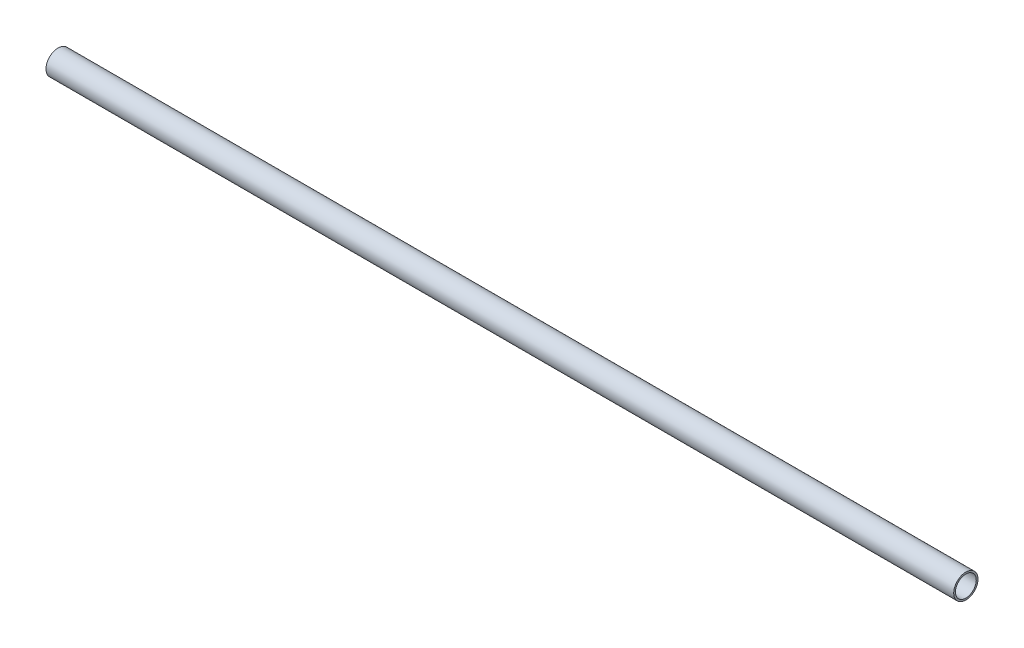
from build123d import *

# Parameters (mm, degrees)
IZIM1_R                     = 7
IZIM1_R_2                   = 6
Y_KSEKLIK_EKSTR_ZYON1_DEPTH = 261.5


with BuildPart() as part:
    # Çizim1 → Yükseklik-Ekstrüzyon1 (new, symmetric)
    with BuildSketch(Plane(origin=(0, 0, 0), x_dir=(0, 0, -1), z_dir=(1, 0, 0))):
        Circle(IZIM1_R)
        Circle(IZIM1_R_2, mode=Mode.SUBTRACT)
    extrude(amount=Y_KSEKLIK_EKSTR_ZYON1_DEPTH, both=True)


solid = part.part
